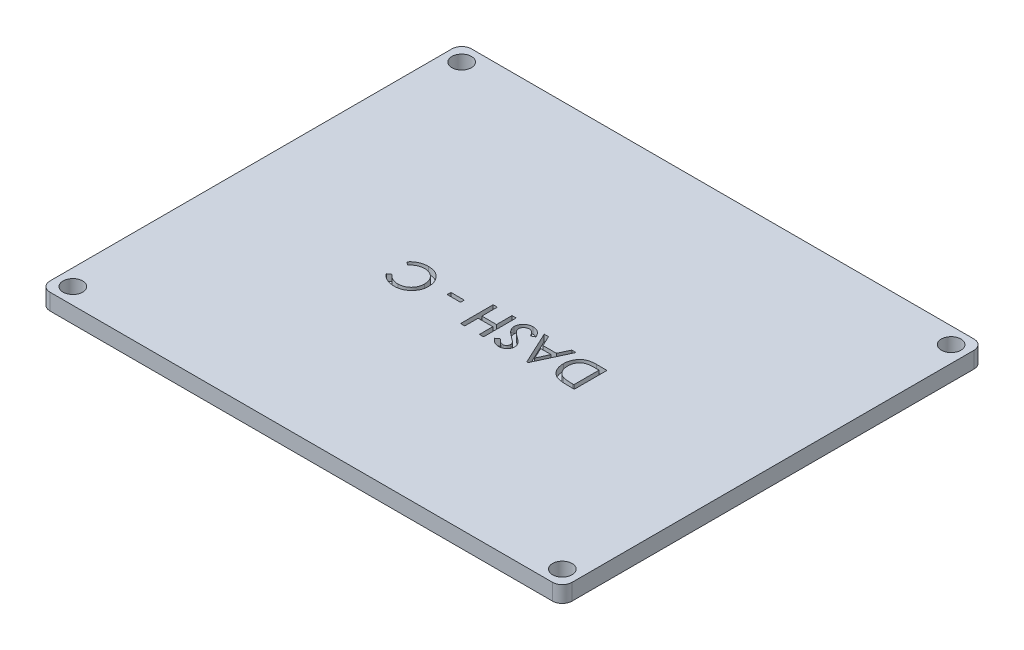
from build123d import *

# Parameters (mm, degrees)
SKETCH4_R           = 1.5
SKETCH4_W           = 21.629909152
SKETCH4_H           = 6.5
BASE_DEPTH          = 2.5
BOSS_EXTRUDE4_DEPTH = 1
SKETCH5_W           = 2.051282051
SKETCH5_H           = 0.576923077
CUT_EXTRUDE2_DEPTH  = 1


with BuildPart() as part:
    # Sketch4 → BASE (new body)
    # profile 1 of 3: a face of its own
    with BuildSketch(Plane(origin=(0, 0, 0), x_dir=(1, 0, 0), z_dir=(0, 1, 0))):
        with BuildLine():
            Line((3.779148753, 24.284106724), (-73.220851247, 24.284106724))
            ThreePointArc((-73.220851247, 24.284106724), (-74.281511419, 23.844766896), (-74.720851247, 22.784106724))
            Line((-74.720851247, 22.784106724), (-74.720851247, -38.800456837))
            ThreePointArc((-74.720851247, -38.800456837), (-74.281511419, -39.861117009), (-73.220851247, -40.300456837))
            Line((-73.220851247, -40.300456837), (3.779148753, -40.300456837))
            ThreePointArc((3.779148753, -40.300456837), (4.839808925, -39.861117009), (5.279148753, -38.800456837))
            Line((5.279148753, -38.800456837), (5.279148753, 22.784106724))
            ThreePointArc((5.279148753, 22.784106724), (4.839808925, 23.844766896), (3.779148753, 24.284106724))
        make_face()
        with Locations(Location((-72.220851247, 21.784106724, 0), (0, 0, 270))):
            Circle(SKETCH4_R, mode=Mode.SUBTRACT)
        with Locations(Location((2.779148753, 21.784106724, 0), (0, 0, 270))):
            Circle(SKETCH4_R, mode=Mode.SUBTRACT)
        with Locations(Location((2.779148753, -37.800456837, 0), (0, 0, 270))):
            Circle(SKETCH4_R, mode=Mode.SUBTRACT)
        with Locations(Location((-72.220851247, -37.800456837, 0), (0, 0, 270))):
            Circle(SKETCH4_R, mode=Mode.SUBTRACT)
        with BuildLine():
            ThreePointArc((-67.97821056, 21.784106724), (-68.844235963, 21.508851596), (-69.392424122, 20.784106724))
            ThreePointArc((-69.392424122, 20.784106724), (-70.099530903, 19.662786381), (-71.220851247, 18.955679599))
            ThreePointArc((-71.220851247, 18.955679599), (-71.945596118, 18.407491441), (-72.220851247, 17.541466037))
            Line((-72.220851247, 17.541466037), (-72.220851247, -33.55781615))
            ThreePointArc((-72.220851247, -33.55781615), (-71.945596118, -34.423841554), (-71.220851247, -34.972029713))
            ThreePointArc((-71.220851247, -34.972029713), (-70.099530903, -35.679136494), (-69.392424122, -36.800456837))
            ThreePointArc((-69.392424122, -36.800456837), (-68.844235963, -37.525201709), (-67.97821056, -37.800456837))
            Line((-67.97821056, -37.800456837), (-1.463491934, -37.800456837))
            ThreePointArc((-1.463491934, -37.800456837), (-0.59746653, -37.525201709), (-0.049278372, -36.800456837))
            ThreePointArc((-0.049278372, -36.800456837), (0.65782841, -35.679136494), (1.779148753, -34.972029713))
            ThreePointArc((1.779148753, -34.972029713), (2.503893625, -34.423841554), (2.779148753, -33.55781615))
            Line((2.779148753, -33.55781615), (2.779148753, 17.541466037))
            ThreePointArc((2.779148753, 17.541466037), (2.503893625, 18.407491441), (1.779148753, 18.955679599))
            ThreePointArc((1.779148753, 18.955679599), (0.65782841, 19.662786381), (-0.049278372, 20.784106724))
            ThreePointArc((-0.049278372, 20.784106724), (-0.59746653, 21.508851596), (-1.463491934, 21.784106724))
            Line((-1.463491934, 21.784106724), (-67.97821056, 21.784106724))
        make_face(mode=Mode.SUBTRACT)
    # profile 2 of 3: a face of its own
    with BuildSketch(Plane(origin=(0, 0, 0), x_dir=(1, 0, 0), z_dir=(0, 1, 0))):
        with BuildLine():
            Line((-1.648537358, 15.284106724), (-23.27844651, 15.284106724))
            Line((-23.27844651, 15.284106724), (-23.27844651, 21.784106724))
            Line((-23.27844651, 21.784106724), (-67.97821056, 21.784106724))
            ThreePointArc((-67.97821056, 21.784106724), (-68.844235963, 21.508851596), (-69.392424122, 20.784106724))
            ThreePointArc((-69.392424122, 20.784106724), (-70.099530903, 19.662786381), (-71.220851247, 18.955679599))
            ThreePointArc((-71.220851247, 18.955679599), (-71.945596118, 18.407491441), (-72.220851247, 17.541466037))
            Line((-72.220851247, 17.541466037), (-72.220851247, -33.55781615))
            ThreePointArc((-72.220851247, -33.55781615), (-71.945596118, -34.423841554), (-71.220851247, -34.972029713))
            ThreePointArc((-71.220851247, -34.972029713), (-70.099530903, -35.679136494), (-69.392424122, -36.800456837))
            ThreePointArc((-69.392424122, -36.800456837), (-68.844235963, -37.525201709), (-67.97821056, -37.800456837))
            Line((-67.97821056, -37.800456837), (-1.463491934, -37.800456837))
            ThreePointArc((-1.463491934, -37.800456837), (-0.59746653, -37.525201709), (-0.049278372, -36.800456837))
            ThreePointArc((-0.049278372, -36.800456837), (0.65782841, -35.679136494), (1.779148753, -34.972029713))
            ThreePointArc((1.779148753, -34.972029713), (2.503893625, -34.423841554), (2.779148753, -33.55781615))
            Line((2.779148753, -33.55781615), (2.779148753, 17.541466037))
            ThreePointArc((2.779148753, 17.541466037), (2.503893625, 18.407491441), (1.779148753, 18.955679599))
            ThreePointArc((1.779148753, 18.955679599), (0.65782841, 19.662786381), (-0.049278372, 20.784106724))
            ThreePointArc((-0.049278372, 20.784106724), (-0.59746653, 21.508851596), (-1.463491934, 21.784106724))
            Line((-1.463491934, 21.784106724), (-1.648537358, 21.784106724))
            Line((-1.648537358, 21.784106724), (-1.648537358, 15.284106724))
        make_face()
    # profile 3 of 3: a face of its own
    with BuildSketch(Plane(origin=(0, 0, 0), x_dir=(1, 0, 0), z_dir=(0, 1, 0))):
        with Locations((-12.463491934, 18.534106724)):
            Rectangle(SKETCH4_W, SKETCH4_H)
    extrude(amount=BASE_DEPTH)

    # Sketch4<3> → Boss-Extrude4 (add)
    with BuildSketch(Plane(origin=(0, 0, 0), x_dir=(1, 0, 0), z_dir=(0, 1, 0))):
        with BuildLine():
            Line((-1.648537358, 15.284106724), (-23.27844651, 15.284106724))
            Line((-23.27844651, 15.284106724), (-23.27844651, 21.784106724))
            Line((-23.27844651, 21.784106724), (-67.97821056, 21.784106724))
            ThreePointArc((-67.97821056, 21.784106724), (-68.844235963, 21.508851596), (-69.392424122, 20.784106724))
            ThreePointArc((-69.392424122, 20.784106724), (-70.099530903, 19.662786381), (-71.220851247, 18.955679599))
            ThreePointArc((-71.220851247, 18.955679599), (-71.945596118, 18.407491441), (-72.220851247, 17.541466037))
            Line((-72.220851247, 17.541466037), (-72.220851247, -33.55781615))
            ThreePointArc((-72.220851247, -33.55781615), (-71.945596118, -34.423841554), (-71.220851247, -34.972029713))
            ThreePointArc((-71.220851247, -34.972029713), (-70.099530903, -35.679136494), (-69.392424122, -36.800456837))
            ThreePointArc((-69.392424122, -36.800456837), (-68.844235963, -37.525201709), (-67.97821056, -37.800456837))
            Line((-67.97821056, -37.800456837), (-1.463491934, -37.800456837))
            ThreePointArc((-1.463491934, -37.800456837), (-0.59746653, -37.525201709), (-0.049278372, -36.800456837))
            ThreePointArc((-0.049278372, -36.800456837), (0.65782841, -35.679136494), (1.779148753, -34.972029713))
            ThreePointArc((1.779148753, -34.972029713), (2.503893625, -34.423841554), (2.779148753, -33.55781615))
            Line((2.779148753, -33.55781615), (2.779148753, 17.541466037))
            ThreePointArc((2.779148753, 17.541466037), (2.503893625, 18.407491441), (1.779148753, 18.955679599))
            ThreePointArc((1.779148753, 18.955679599), (0.65782841, 19.662786381), (-0.049278372, 20.784106724))
            ThreePointArc((-0.049278372, 20.784106724), (-0.59746653, 21.508851596), (-1.463491934, 21.784106724))
            Line((-1.463491934, 21.784106724), (-1.648537358, 21.784106724))
            Line((-1.648537358, 21.784106724), (-1.648537358, 15.284106724))
        make_face()
    extrude(amount=-BOSS_EXTRUDE4_DEPTH)

    # Sketch5 → Cut-Extrude2 (cut)
    # profile 1 of 6: a face of its own
    with BuildSketch(Plane(origin=(0, 2.5, 0), x_dir=(1, 0, 0), z_dir=(0, 1, 0))):
        with BuildLine():
            Line((-20.169569196, -8.008175057), (-20.169569196, -13.008175057))
            Line((-20.169569196, -13.008175057), (-21.228263106, -13.008175057))
            add(Edge.make_bspline(
                [(-21.228263106, -13.008175057), (-21.317077458, -13.007540896), (-21.488733973, -13.006315219), (-21.736565094, -12.998597701), (-21.965736374, -12.984877499), (-22.175489372, -12.964879377), (-22.366778298, -12.940499824), (-22.538504739, -12.909438817), (-22.692195617, -12.874667866), (-22.786284791, -12.843597234), (-22.830827208, -12.828888198)],
                knots=[0, 0, 0, 0, 1.316453175, 2.544383385, 3.67482516, 4.718766669, 5.667135044, 6.532035698, 7.30505631, 8, 8, 8, 8], degree=3))
            add(Edge.make_bspline(
                [(-22.830827208, -12.828888198), (-22.892709181, -12.8055703), (-23.014848086, -12.759546842), (-23.187902399, -12.673154877), (-23.351397033, -12.578373671), (-23.503294898, -12.470785669), (-23.64330593, -12.351068626), (-23.773832943, -12.221837329), (-23.890848511, -12.079323951), (-23.998035389, -11.927550551), (-24.093007422, -11.766341607), (-24.175213948, -11.597814617), (-24.244644343, -11.42229318), (-24.301745123, -11.2402241), (-24.345506441, -11.051279626), (-24.377843735, -10.855973796), (-24.397166029, -10.653801241), (-24.399272087, -10.516563526), (-24.400338426, -10.4470773)],
                knots=[0, 0, 0, 0, 1.037989101, 2.048720264, 3.03347809, 4.003905725, 4.967380877, 5.923996735, 6.884742632, 7.859453364, 8.839691521, 9.819957728, 10.801471334, 11.80152298, 12.813966534, 13.844978706, 14.908869198, 16, 16, 16, 16], degree=3))
            add(Edge.make_bspline(
                [(-24.400338426, -10.4470773), (-24.39940617, -10.386948591), (-24.397564579, -10.268169684), (-24.382007255, -10.092249806), (-24.35733588, -9.921283244), (-24.322249056, -9.755304716), (-24.276786477, -9.594928428), (-24.223176991, -9.438881764), (-24.157629103, -9.288496006), (-24.082649714, -9.143824851), (-23.999932919, -9.005812755), (-23.909615964, -8.876521063), (-23.813000777, -8.755681937), (-23.710614002, -8.643497614), (-23.600124939, -8.541737311), (-23.484107617, -8.448542707), (-23.36138786, -8.363934616), (-23.231295226, -8.288304504), (-23.09135208, -8.220955487), (-22.938724621, -8.164897296), (-22.773647425, -8.115337261), (-22.595576501, -8.07561797), (-22.404420027, -8.046195872), (-22.200874035, -8.024517981), (-21.984355579, -8.009750576), (-21.83559397, -8.008710025), (-21.759112465, -8.008175057)],
                knots=[0, 0, 0, 0, 1.058195957, 2.090371799, 3.105952959, 4.097166534, 5.073902656, 6.038470904, 6.999164648, 7.958509418, 8.904860942, 9.829207291, 10.732293636, 11.626483498, 12.499746999, 13.373465164, 14.243916342, 15.120810563, 16.019757454, 16.973741554, 17.979601886, 19.051723033, 20.182109548, 21.38204443, 22.654053397, 24, 24, 24, 24], degree=3))
            Line((-21.759112465, -8.008175057), (-20.169569196, -8.008175057))
        make_face()
        with BuildLine():
            Line((-20.810594837, -8.585098133), (-21.245290349, -8.585098133))
            add(Edge.make_bspline(
                [(-21.245290349, -8.585098133), (-21.325424979, -8.585405265), (-21.479374874, -8.585995307), (-21.700733651, -8.59258775), (-21.902550454, -8.600356618), (-22.084812185, -8.615118104), (-22.247646225, -8.631168924), (-22.391322053, -8.652269665), (-22.515798174, -8.675888636), (-22.590910325, -8.698077507), (-22.625498683, -8.708295249)],
                knots=[0, 0, 0, 0, 1.383621145, 2.658130832, 3.823793454, 4.870354837, 5.81512834, 6.648349115, 7.377578956, 8, 8, 8, 8], degree=3))
            add(Edge.make_bspline(
                [(-22.625498683, -8.708295249), (-22.668492947, -8.723666521), (-22.753420443, -8.754029725), (-22.87511123, -8.810530851), (-22.989800661, -8.875705202), (-23.097104119, -8.950139864), (-23.197927884, -9.032856148), (-23.292352474, -9.123760421), (-23.378697758, -9.224722186), (-23.457501551, -9.333732971), (-23.528894232, -9.45005492), (-23.590991666, -9.573289746), (-23.643224661, -9.702958412), (-23.685250419, -9.839076293), (-23.718212883, -9.981693669), (-23.742253924, -10.130900735), (-23.756274816, -10.286551881), (-23.758288585, -10.392294914), (-23.759312785, -10.446075698)],
                knots=[0, 0, 0, 0, 0.982752151, 1.941251509, 2.884642607, 3.81989091, 4.749569158, 5.690107307, 6.638279664, 7.606035175, 8.583752337, 9.573969829, 10.573847701, 11.590232413, 12.638259993, 13.723212808, 14.842028696, 16, 16, 16, 16], degree=3))
            add(Edge.make_bspline(
                [(-23.759312785, -10.446075698), (-23.75851108, -10.502547068), (-23.756932757, -10.613722743), (-23.739693896, -10.777177146), (-23.715820857, -10.934753093), (-23.679078287, -11.085558089), (-23.633456343, -11.230526583), (-23.575882021, -11.368440896), (-23.509883921, -11.500909045), (-23.432575793, -11.625509377), (-23.347026315, -11.743171201), (-23.251012939, -11.850011271), (-23.148982891, -11.949466624), (-23.037002089, -12.036989819), (-22.918523576, -12.117289304), (-22.790993756, -12.185751877), (-22.655836032, -12.245864738), (-22.56136134, -12.27713123), (-22.513319196, -12.293030826)],
                knots=[0, 0, 0, 0, 1.129085377, 2.22284013, 3.2845041, 4.314657898, 5.324171549, 6.321261515, 7.300843857, 8.281268068, 9.250966941, 10.206512586, 11.151121256, 12.097074499, 13.045382033, 14.010586467, 14.988346074, 16, 16, 16, 16], degree=3))
            add(Edge.make_bspline(
                [(-22.513319196, -12.293030826), (-22.472710001, -12.304227493), (-22.386132205, -12.328098509), (-22.245433205, -12.355005933), (-22.087132352, -12.379344765), (-21.910206207, -12.397195876), (-21.715299426, -12.414222484), (-21.50174729, -12.422634481), (-21.27039014, -12.430649905), (-21.11008316, -12.43104636), (-21.02694099, -12.43125198)],
                knots=[0, 0, 0, 0, 0.675044765, 1.439178701, 2.294511703, 3.241955575, 4.289123713, 5.430378163, 6.667282384, 8, 8, 8, 8], degree=3))
            Line((-21.02694099, -12.43125198), (-20.810594837, -12.43125198))
            Line((-20.810594837, -12.43125198), (-20.810594837, -8.585098133))
        make_face(mode=Mode.SUBTRACT)
    # profile 2 of 6: a face of its own
    with BuildSketch(Plane(origin=(0, 2.5, 0), x_dir=(1, 0, 0), z_dir=(0, 1, 0))):
        Polygon((-27.445210221, -13.008175057), (-29.784953811, -8.008175057), (-29.126900926, -8.008175057), (-28.367686183, -9.610739159), (-26.322413747, -9.610739159), (-25.563199003, -8.008175057), (-24.913158939, -8.008175057), (-27.244889708, -13.008175057), align=None)
        Polygon((-27.345049965, -11.915426659), (-26.566804772, -10.187662236), (-28.131307978, -10.187662236), align=None, mode=Mode.SUBTRACT)
    # profile 3 of 6: a face of its own
    with BuildSketch(Plane(origin=(0, 2.5, 0), x_dir=(1, 0, 0), z_dir=(0, 1, 0))):
        with BuildLine():
            Line((-30.041364067, -8.999761595), (-30.586235862, -9.290226339))
            add(Edge.make_bspline(
                [(-30.586235862, -9.290226339), (-30.625943736, -9.224453309), (-30.701836482, -9.098742829), (-30.826456223, -8.929395888), (-30.950361999, -8.784987454), (-31.074776907, -8.665663334), (-31.201429165, -8.573340228), (-31.329025794, -8.506616391), (-31.458365395, -8.464678241), (-31.545816075, -8.459460183), (-31.588840029, -8.456893005)],
                knots=[0, 0, 0, 0, 1.354943589, 2.589672558, 3.704607527, 4.708856974, 5.624398268, 6.459549776, 7.242129862, 8, 8, 8, 8], degree=3))
            add(Edge.make_bspline(
                [(-31.588840029, -8.456893005), (-31.629008062, -8.458177557), (-31.708569381, -8.460721885), (-31.825419193, -8.482994805), (-31.938889953, -8.516465328), (-32.045925099, -8.566015751), (-32.145200831, -8.624772136), (-32.233440671, -8.694177977), (-32.308572695, -8.772967837), (-32.369776474, -8.860906219), (-32.417965484, -8.953886539), (-32.452386334, -9.050917081), (-32.473037796, -9.151133858), (-32.475847886, -9.219017934), (-32.477261503, -9.253167044)],
                knots=[0, 0, 0, 0, 1.088711937, 2.156425153, 3.216543554, 4.290691142, 5.346933412, 6.339926723, 7.326538423, 8.288906172, 9.236802047, 10.159214894, 11.073992371, 12, 12, 12, 12], degree=3))
            add(Edge.make_bspline(
                [(-32.477261503, -9.253167044), (-32.475419445, -9.292122015), (-32.471693011, -9.370926874), (-32.437911711, -9.487133493), (-32.38804497, -9.603526016), (-32.339957766, -9.675533041), (-32.315001888, -9.712902621)],
                knots=[0, 0, 0, 0, 0.942144539, 1.905933023, 2.913239343, 4, 4, 4, 4], degree=3))
            add(Edge.make_bspline(
                [(-32.315001888, -9.712902621), (-32.29354855, -9.740150131), (-32.248387451, -9.797508454), (-32.1718733, -9.883787481), (-32.082821199, -9.97397402), (-31.979431654, -10.066180897), (-31.867168065, -10.166248791), (-31.7402819, -10.267664235), (-31.601902567, -10.374008769), (-31.504847406, -10.445262478), (-31.454625285, -10.48213339)],
                knots=[0, 0, 0, 0, 0.718605451, 1.5127255, 2.388525841, 3.34361075, 4.383114545, 5.504804886, 6.708837455, 8, 8, 8, 8], degree=3))
            add(Edge.make_bspline(
                [(-31.454625285, -10.48213339), (-31.403419304, -10.519358483), (-31.305169365, -10.590783012), (-31.166743779, -10.695491704), (-31.042631769, -10.792038919), (-30.933785074, -10.88050012), (-30.840191323, -10.961644173), (-30.762047678, -11.035138107), (-30.697001691, -11.098965055), (-30.662047833, -11.141910822), (-30.646332016, -11.161219928)],
                knots=[0, 0, 0, 0, 1.435833971, 2.754963323, 3.936484598, 5.002077172, 5.935979083, 6.744956812, 7.435712417, 8, 8, 8, 8], degree=3))
            add(Edge.make_bspline(
                [(-30.646332016, -11.161219928), (-30.623389048, -11.190864476), (-30.578315741, -11.249103576), (-30.521251374, -11.342522862), (-30.472148764, -11.43716479), (-30.431705484, -11.533905683), (-30.400364377, -11.632436489), (-30.378803178, -11.733102747), (-30.363594283, -11.83550459), (-30.362451415, -11.904686791), (-30.361876888, -11.939465121)],
                knots=[0, 0, 0, 0, 1.064105702, 2.090521257, 3.104283852, 4.09061442, 5.065433238, 6.036507983, 7.012940167, 8, 8, 8, 8], degree=3))
            add(Edge.make_bspline(
                [(-30.361876888, -11.939465121), (-30.363668527, -11.993708476), (-30.367215842, -12.101106352), (-30.399547304, -12.258077467), (-30.450678859, -12.408257527), (-30.523206447, -12.549134553), (-30.613033923, -12.679476535), (-30.720303271, -12.796170475), (-30.845212526, -12.897013272), (-30.984848448, -12.982261023), (-31.135363239, -13.051390386), (-31.293889591, -13.10066439), (-31.458506934, -13.130535619), (-31.570353642, -13.134417559), (-31.626900926, -13.136380185)],
                knots=[0, 0, 0, 0, 1.004538361, 1.98891246, 2.957754601, 3.937604432, 4.916182936, 5.884154884, 6.865254872, 7.882148152, 8.909646262, 9.927556077, 10.952217026, 12, 12, 12, 12], degree=3))
            add(Edge.make_bspline(
                [(-31.626900926, -13.136380185), (-31.691135091, -13.134224133), (-31.818406935, -13.129952191), (-32.005405846, -13.097032367), (-32.185168975, -13.043554392), (-32.32930681, -12.981794731), (-32.441468498, -12.919188884), (-32.52628053, -12.862568539), (-32.613213845, -12.798511664), (-32.69950826, -12.723799977), (-32.788529054, -12.642055498), (-32.875717075, -12.548832648), (-32.96659016, -12.449474755), (-33.024509332, -12.377820336), (-33.05418458, -12.341107749)],
                knots=[0, 0, 0, 0, 1.360687177, 2.696028959, 4.010076158, 5.328383209, 6.009416266, 6.72960499, 7.488083515, 8.296188009, 9.147227534, 10.04798982, 10.999875445, 12, 12, 12, 12], degree=3))
            Line((-33.05418458, -12.341107749), (-32.531348042, -11.982534031))
            add(Edge.make_bspline(
                [(-32.531348042, -11.982534031), (-32.504121806, -12.0117248), (-32.451613108, -12.068022311), (-32.373486116, -12.146862699), (-32.300427126, -12.218061261), (-32.232332226, -12.281610063), (-32.1682093, -12.336768921), (-32.1086898, -12.384016837), (-32.053013843, -12.422056873), (-31.987032583, -12.463970588), (-31.903089723, -12.502310454), (-31.800267687, -12.535612116), (-31.693064816, -12.555106243), (-31.620634415, -12.557991227), (-31.583832016, -12.559457108)],
                knots=[0, 0, 0, 0, 1.253255604, 2.417037033, 3.484535688, 4.456276324, 5.340879413, 6.139846054, 6.840628373, 7.457335203, 8.592193832, 9.725986821, 10.844557802, 12, 12, 12, 12], degree=3))
            add(Edge.make_bspline(
                [(-31.583832016, -12.559457108), (-31.544568469, -12.557608526), (-31.468236927, -12.554014731), (-31.358787211, -12.523731741), (-31.258519078, -12.475030923), (-31.169840861, -12.406775414), (-31.094806965, -12.322975487), (-31.040726812, -12.223656488), (-31.008933559, -12.110980519), (-31.004969607, -12.031824348), (-31.002902529, -11.990546851)],
                knots=[0, 0, 0, 0, 1.033786987, 2.00976631, 2.970458119, 3.95651055, 4.942051941, 5.915168215, 6.91282465, 8, 8, 8, 8], degree=3))
            add(Edge.make_bspline(
                [(-31.002902529, -11.990546851), (-31.003703104, -11.96380058), (-31.005302317, -11.910372729), (-31.017248206, -11.831275528), (-31.038800583, -11.754557371), (-31.068035575, -11.679578218), (-31.106697212, -11.605741836), (-31.154979643, -11.532594872), (-31.213893234, -11.45968394), (-31.25890905, -11.413588229), (-31.282349644, -11.389585313)],
                knots=[0, 0, 0, 0, 0.941102048, 1.879927795, 2.806320176, 3.740133313, 4.70706341, 5.733547381, 6.819814909, 8, 8, 8, 8], degree=3))
            add(Edge.make_bspline(
                [(-31.282349644, -11.389585313), (-31.294230609, -11.378408287), (-31.321499914, -11.352754668), (-31.371514749, -11.313471369), (-31.432450029, -11.264220606), (-31.505150534, -11.205806236), (-31.592006821, -11.141399665), (-31.689807505, -11.066698004), (-31.801028909, -10.985064236), (-31.879295723, -10.927833426), (-31.920370478, -10.897798454)],
                knots=[0, 0, 0, 0, 0.485581606, 1.114511607, 1.892484918, 2.819534315, 3.891398566, 5.11240712, 6.484579029, 8, 8, 8, 8], degree=3))
            add(Edge.make_bspline(
                [(-31.920370478, -10.897798454), (-31.976336864, -10.857016915), (-32.084605788, -10.778123607), (-32.238297322, -10.659002535), (-32.377102369, -10.542832895), (-32.503176327, -10.431461263), (-32.615408467, -10.324086051), (-32.71274791, -10.219234097), (-32.797662971, -10.119919565), (-32.888181239, -9.993167839), (-32.979238572, -9.837276799), (-33.058263611, -9.647774291), (-33.108561837, -9.458075412), (-33.11507466, -9.330914079), (-33.118287144, -9.268191082)],
                knots=[0, 0, 0, 0, 1.186639563, 2.29559556, 3.331401308, 4.287832086, 5.178002532, 5.991653193, 6.738845359, 7.415240842, 8.658551622, 9.823054859, 10.926210341, 12, 12, 12, 12], degree=3))
            add(Edge.make_bspline(
                [(-33.118287144, -9.268191082), (-33.116867923, -9.223714507), (-33.114047113, -9.135313912), (-33.093594921, -9.004608289), (-33.059565759, -8.877565661), (-33.010603271, -8.754728463), (-32.949552434, -8.634920971), (-32.873776791, -8.519278853), (-32.784035927, -8.408090208), (-32.682600815, -8.301822702), (-32.571691457, -8.203066418), (-32.451849464, -8.11660395), (-32.325335577, -8.042701358), (-32.191126748, -7.984162404), (-32.051395037, -7.936137882), (-31.90427963, -7.903335512), (-31.750597153, -7.88437943), (-31.645984109, -7.881455251), (-31.592846439, -7.879969928)],
                knots=[0, 0, 0, 0, 0.932738639, 1.853889356, 2.767877299, 3.686041414, 4.622558463, 5.584089528, 6.580490983, 7.61578374, 8.662665956, 9.690923261, 10.710750907, 11.729736566, 12.757349726, 13.805636525, 14.885384091, 16, 16, 16, 16], degree=3))
            add(Edge.make_bspline(
                [(-31.592846439, -7.879969928), (-31.554098058, -7.880830579), (-31.477779768, -7.882525706), (-31.364479345, -7.893278196), (-31.25422392, -7.913944376), (-31.146408999, -7.940663664), (-31.040967294, -7.974687069), (-30.939257657, -8.018209243), (-30.839586385, -8.068200474), (-30.742525243, -8.126735027), (-30.647950457, -8.195274379), (-30.555324572, -8.274835087), (-30.465185629, -8.366815728), (-30.375988455, -8.470021282), (-30.288911463, -8.585612596), (-30.204157944, -8.712981853), (-30.120645745, -8.851718326), (-30.06831218, -8.949441183), (-30.041364067, -8.999761595)],
                knots=[0, 0, 0, 0, 0.916943493, 1.805999526, 2.689245248, 3.568702553, 4.433092864, 5.307568578, 6.183755457, 7.069823058, 7.986358083, 8.944343836, 9.955449961, 11.030835633, 12.170024038, 13.377301724, 14.649494474, 16, 16, 16, 16], degree=3))
        make_face()
    # profile 4 of 6: a face of its own
    with BuildSketch(Plane(origin=(0, 2.5, 0), x_dir=(1, 0, 0), z_dir=(0, 1, 0))):
        Polygon((-34.079825606, -13.008175057), (-34.720851247, -13.008175057), (-34.720851247, -10.956893005), (-36.96444099, -10.956893005), (-36.96444099, -13.008175057), (-37.605466631, -13.008175057), (-37.605466631, -8.008175057), (-36.96444099, -8.008175057), (-36.96444099, -10.379969928), (-34.720851247, -10.379969928), (-34.720851247, -8.008175057), (-34.079825606, -8.008175057), align=None)
    # profile 5 of 6: a face of its own
    with BuildSketch(Plane(origin=(0, 2.5, 0), x_dir=(1, 0, 0), z_dir=(0, 1, 0))):
        with Locations((-41.451620478, -9.899200698)):
            Rectangle(SKETCH5_W, SKETCH5_H)
    # profile 6 of 6: a face of its own
    with BuildSketch(Plane(origin=(0, 2.5, 0), x_dir=(1, 0, 0), z_dir=(0, 1, 0))):
        with BuildLine():
            Line((-49.913158939, -12.078687877), (-49.402341631, -11.726123774))
            add(Edge.make_bspline(
                [(-49.402341631, -11.726123774), (-49.341171016, -11.793153329), (-49.221422233, -11.924371686), (-49.024251182, -12.095835562), (-48.818619729, -12.241089925), (-48.602614183, -12.357983113), (-48.376544137, -12.449105892), (-48.139840196, -12.51296027), (-47.892227561, -12.552119222), (-47.723467592, -12.556980999), (-47.637517913, -12.559457108)],
                knots=[0, 0, 0, 0, 1.078665139, 2.111615787, 3.100958101, 4.067620245, 5.026287893, 5.993512721, 6.97809333, 8, 8, 8, 8], degree=3))
            add(Edge.make_bspline(
                [(-47.637517913, -12.559457108), (-47.592740728, -12.558813855), (-47.503661012, -12.557534167), (-47.371667921, -12.543386465), (-47.241644422, -12.524183134), (-47.114351896, -12.494482116), (-46.988608837, -12.457872939), (-46.865701741, -12.410963731), (-46.743934459, -12.358625976), (-46.626349605, -12.296024892), (-46.512145559, -12.227543246), (-46.404052058, -12.151104297), (-46.301625723, -12.06888452), (-46.205378618, -11.980782589), (-46.115541112, -11.886428511), (-46.033791742, -11.784373975), (-45.956209579, -11.677696404), (-45.886435948, -11.564271367), (-45.823030952, -11.446102043), (-45.768091705, -11.323267966), (-45.722023582, -11.196292755), (-45.68341128, -11.065660752), (-45.654958386, -10.93057714), (-45.633832107, -10.79148365), (-45.62030081, -10.648668078), (-45.618962164, -10.551941793), (-45.618287144, -10.503167044)],
                knots=[0, 0, 0, 0, 1.002100226, 1.993577825, 2.969377105, 3.943141467, 4.917594164, 5.899216777, 6.886656674, 7.883053253, 8.879141355, 9.866298277, 10.844585276, 11.818062689, 12.785696622, 13.758169043, 14.743569709, 15.737186542, 16.737081863, 17.744243374, 18.746901034, 19.759319309, 20.791469149, 21.834898767, 22.908236068, 24, 24, 24, 24], degree=3))
            add(Edge.make_bspline(
                [(-45.618287144, -10.503167044), (-45.61983429, -10.429951509), (-45.622862875, -10.286629875), (-45.652066992, -10.076754524), (-45.697788422, -9.876813291), (-45.761567308, -9.68639618), (-45.845912575, -9.506932288), (-45.946953812, -9.337022901), (-46.067526013, -9.177471051), (-46.20500171, -9.029818039), (-46.354925076, -8.894826848), (-46.516557697, -8.778145777), (-46.686336709, -8.678322431), (-46.865399608, -8.596496825), (-47.053818473, -8.534910552), (-47.250467475, -8.489391038), (-47.456118368, -8.461921746), (-47.596368812, -8.458586248), (-47.66756599, -8.456893005)],
                knots=[0, 0, 0, 0, 1.083827419, 2.121625089, 3.131589635, 4.118286758, 5.089447913, 6.062985408, 7.041070793, 8.045305549, 9.046870647, 10.024093186, 10.992594501, 11.959617776, 12.933795513, 13.923375387, 14.945815715, 16, 16, 16, 16], degree=3))
            add(Edge.make_bspline(
                [(-47.66756599, -8.456893005), (-47.749856877, -8.459329378), (-47.912711931, -8.464151), (-48.152615264, -8.504673448), (-48.384223707, -8.569616532), (-48.607011398, -8.661543964), (-48.820778344, -8.779879979), (-49.025701694, -8.924462798), (-49.223455542, -9.093834631), (-49.34319016, -9.223830639), (-49.404344837, -9.290226339)],
                knots=[0, 0, 0, 0, 0.992433147, 1.964041969, 2.926925348, 3.889783442, 4.865293252, 5.868947121, 6.911560824, 8, 8, 8, 8], degree=3))
            Line((-49.404344837, -9.290226339), (-49.913158939, -8.939665441))
            add(Edge.make_bspline(
                [(-49.913158939, -8.939665441), (-49.880220464, -8.89789397), (-49.814775997, -8.814899488), (-49.709088632, -8.697506093), (-49.598075118, -8.5871017), (-49.480652506, -8.484693061), (-49.356908369, -8.390444274), (-49.22794404, -8.303278248), (-49.093006602, -8.223926085), (-48.952963435, -8.151883433), (-48.807678179, -8.08744995), (-48.657192893, -8.032750114), (-48.502730518, -7.985612722), (-48.344034028, -7.946206902), (-48.180777049, -7.916261616), (-48.013193645, -7.895710766), (-47.84174214, -7.881927872), (-47.726020117, -7.880627021), (-47.66756599, -7.879969928)],
                knots=[0, 0, 0, 0, 0.990204069, 1.967406738, 2.938799461, 3.903646712, 4.865927556, 5.833114707, 6.800042149, 7.778627756, 8.763844049, 9.756950948, 10.757809043, 11.76941904, 12.799649885, 13.845902149, 14.911910571, 16, 16, 16, 16], degree=3))
            add(Edge.make_bspline(
                [(-47.66756599, -7.879969928), (-47.61378877, -7.880334434), (-47.507784117, -7.881052941), (-47.351124788, -7.893122541), (-47.198618363, -7.909447451), (-47.050668876, -7.93392377), (-46.906603702, -7.963285523), (-46.767506342, -8.002025316), (-46.631944668, -8.045868082), (-46.500402892, -8.096436447), (-46.374596443, -8.156598019), (-46.25134328, -8.220101024), (-46.133400717, -8.292357725), (-46.020194898, -8.371951028), (-45.910487442, -8.457085635), (-45.805362757, -8.549600751), (-45.70373386, -8.648333374), (-45.640876306, -8.71955945), (-45.609272721, -8.755370569)],
                knots=[0, 0, 0, 0, 1.116142851, 2.200119971, 3.260255731, 4.2994977, 5.312259453, 6.311073155, 7.295253207, 8.269645794, 9.234002153, 10.188921358, 11.147055111, 12.102728696, 13.060812305, 14.028451165, 15.008742661, 16, 16, 16, 16], degree=3))
            add(Edge.make_bspline(
                [(-45.609272721, -8.755370569), (-45.55861431, -8.817549192), (-45.458200911, -8.940797567), (-45.330166188, -9.141108788), (-45.220100077, -9.349406054), (-45.131663521, -9.568778456), (-45.062989678, -9.797202184), (-45.012201572, -10.034897968), (-44.983138547, -10.282421085), (-44.979242404, -10.450675165), (-44.977261503, -10.536219928)],
                knots=[0, 0, 0, 0, 0.995980648, 1.974199336, 2.948512345, 3.920065205, 4.90841171, 5.909314727, 6.937041072, 8, 8, 8, 8], degree=3))
            add(Edge.make_bspline(
                [(-44.977261503, -10.536219928), (-44.979492329, -10.626152881), (-44.983881339, -10.803090352), (-45.020888014, -11.062816087), (-45.081080338, -11.311316966), (-45.164280106, -11.54972423), (-45.273101456, -11.77634923), (-45.405315006, -11.992749109), (-45.56253407, -12.197108622), (-45.740855725, -12.38929655), (-45.936562744, -12.564614691), (-46.146927325, -12.718351178), (-46.370667896, -12.846274411), (-46.604876912, -12.953688073), (-46.851738382, -13.036000703), (-47.110855337, -13.093662046), (-47.381772847, -13.129539624), (-47.566625907, -13.134075422), (-47.660554772, -13.136380185)],
                knots=[0, 0, 0, 0, 1.034221628, 2.034766487, 3.01105043, 3.971920721, 4.933980136, 5.897701862, 6.884080418, 7.895112456, 8.909749417, 9.902337604, 10.886590116, 11.86977038, 12.862091007, 13.874020013, 14.919731768, 16, 16, 16, 16], degree=3))
            add(Edge.make_bspline(
                [(-47.660554772, -13.136380185), (-47.719673275, -13.13569565), (-47.836722388, -13.134340336), (-48.010261105, -13.120949198), (-48.179395911, -13.098968886), (-48.344160584, -13.068692059), (-48.505042798, -13.031278952), (-48.661191091, -12.982495437), (-48.813490252, -12.926766501), (-48.960915114, -12.862424611), (-49.103103913, -12.790847327), (-49.238444633, -12.71009898), (-49.36787245, -12.623278719), (-49.490355707, -12.528576928), (-49.606710778, -12.427555051), (-49.716369407, -12.31905033), (-49.818760253, -12.202622712), (-49.881587355, -12.120137808), (-49.913158939, -12.078687877)],
                knots=[0, 0, 0, 0, 1.097463626, 2.172875475, 3.229307817, 4.262776093, 5.282168658, 6.293918414, 7.298043722, 8.291879901, 9.278790577, 10.251524626, 11.216027204, 12.170719329, 13.124142787, 14.075306658, 15.032812027, 16, 16, 16, 16], degree=3))
        make_face()
    extrude(amount=-CUT_EXTRUDE2_DEPTH, mode=Mode.SUBTRACT)


solid = part.part
